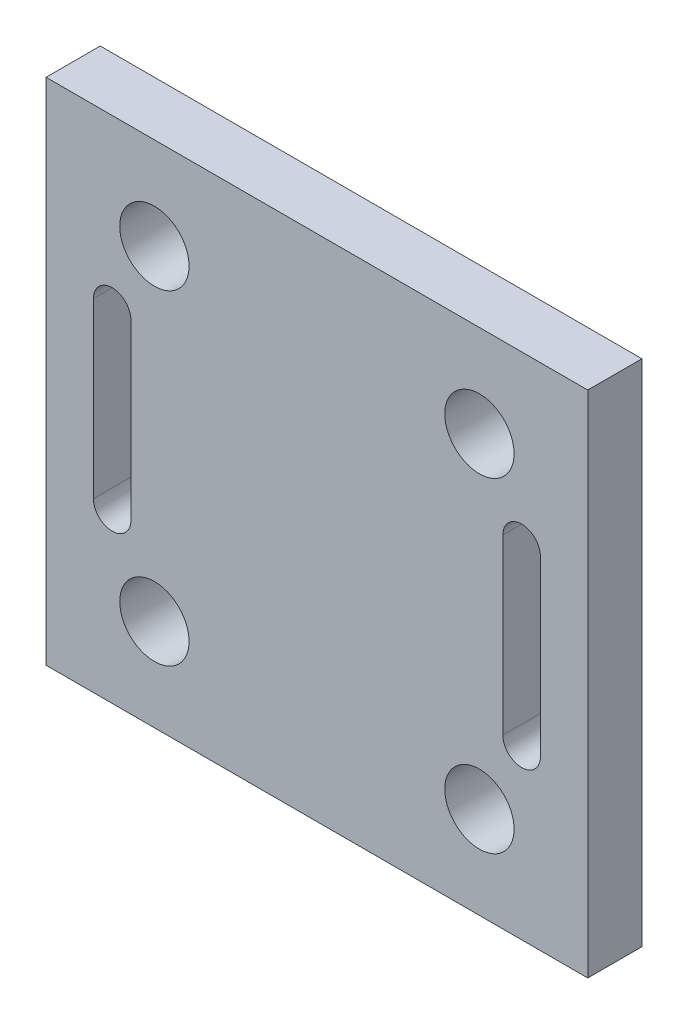
from build123d import *

# Parameters (mm, degrees)
SKETCH2_W                     = 31.75
SKETCH2_H                     = 29.845
BOSS_EXTRUDE1_DEPTH           = 3.175
F_0_16_4_064_DIAMETER_HOLE1_D = 4.064


with BuildPart() as part:
    # Sketch2 → Boss-Extrude1 (new body)
    with BuildSketch(Plane.XY):
        with Locations((15.875, 14.9225)):
            Rectangle(SKETCH2_W, SKETCH2_H)
        with BuildLine():
            Line((2.775, 9.8425), (2.775, 20.0025))
            ThreePointArc((2.775, 20.0025), (3.875, 21.1025), (4.975, 20.0025))
            Line((4.975, 20.0025), (4.975, 9.8425))
            ThreePointArc((4.975, 9.8425), (3.875, 8.7425), (2.775, 9.8425))
        make_face(mode=Mode.SUBTRACT)
        with BuildLine():
            Line((28.975, 9.8425), (28.975, 20.0025))
            ThreePointArc((28.975, 20.0025), (27.875, 21.1025), (26.775, 20.0025))
            Line((26.775, 20.0025), (26.775, 9.8425))
            ThreePointArc((26.775, 9.8425), (27.875, 8.7425), (28.975, 9.8425))
        make_face(mode=Mode.SUBTRACT)
    extrude(amount=BOSS_EXTRUDE1_DEPTH)

    # Ø0.16 (4.064) Diameter Hole1 (through all)
    with Locations(Plane(origin=(0, 0, 0), x_dir=(-1, 0, 0), z_dir=(0, 0, -1))):
        with Locations((-25.4, 24.4475), (-6.35, 24.4475), (-6.35, 5.3975), (-25.4, 5.3975)):
            Hole(F_0_16_4_064_DIAMETER_HOLE1_D / 2)


solid = part.part
